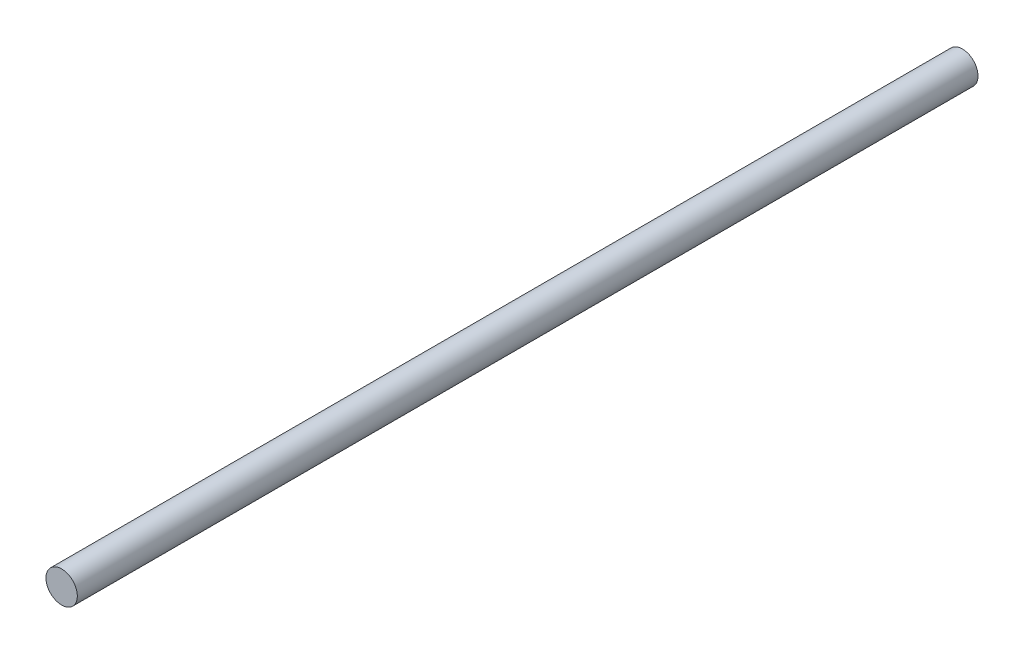
from build123d import *

# Parameters (mm, degrees)
SKETCH_1_R      = 6
EXTRUDE_1_DEPTH = 172.3


with BuildPart() as part:
    # Эскиз1 → Бобышка-Вытянуть1 (new body)
    with BuildSketch(Plane.XY):
        Circle(SKETCH_1_R)
    extrude(amount=EXTRUDE_1_DEPTH)

    # Зеркальное отражение1: part across plane


with BuildPart() as part_1:
    add(part.part)
    add(part.part.mirror(Plane.XY))


solid = part_1.part
